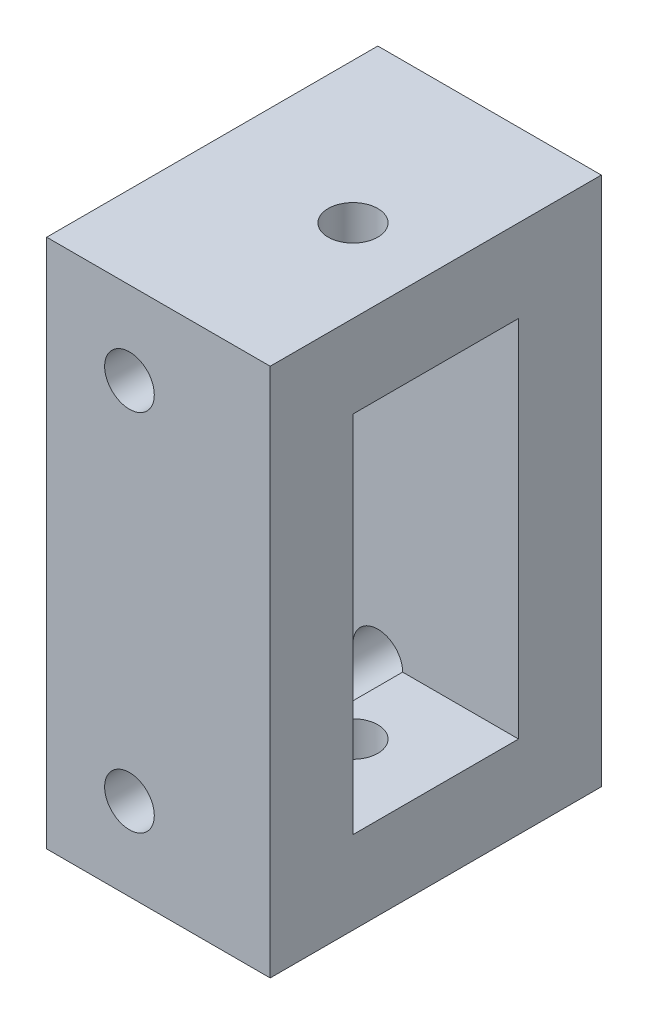
from build123d import *

# Parameters (mm, degrees)
SKETCH1_W           = 13.5
SKETCH1_H           = 20
BOSS_EXTRUDE1_DEPTH = 32
SKETCH2_R           = 1.5
CUT_EXTRUDE1_DEPTH  = 41.078048855
SKETCH3_R           = 1.5
CUT_EXTRUDE2_DEPTH  = 41.078048855
SKETCH4_W           = 10
SKETCH4_H           = 22
CUT_EXTRUDE3_DEPTH  = 41.078048855


with BuildPart() as part:
    # Sketch1 → Boss-Extrude1 (new body)
    with BuildSketch(Plane(origin=(0, 0, 0), x_dir=(1, 0, 0), z_dir=(0, 1, 0))):
        with Locations((6.75, -10)):
            Rectangle(SKETCH1_W, SKETCH1_H)
    extrude(amount=BOSS_EXTRUDE1_DEPTH)

    # Sketch2 → Cut-Extrude1 (cut, through all)
    with BuildSketch(Plane.XY.offset(20)):
        with Locations((5, 27)):
            Circle(SKETCH2_R)
        with Locations((5, 5)):
            Circle(SKETCH2_R)
    extrude(amount=-CUT_EXTRUDE1_DEPTH, mode=Mode.SUBTRACT)

    # Sketch3 → Cut-Extrude2 (cut, through all)
    with BuildSketch(Plane(origin=(0, 32, 0), x_dir=(1, 0, 0), z_dir=(0, 1, 0))):
        with Locations(Location((8.5, -10, 0), (0, 0, 270))):
            Circle(SKETCH3_R)
    extrude(amount=-CUT_EXTRUDE2_DEPTH, mode=Mode.SUBTRACT)

    # Sketch4 → Cut-Extrude3 (cut, through all)
    with BuildSketch(Plane(origin=(13.5, 0, 0), x_dir=(0, 0, -1), z_dir=(1, 0, 0))):
        with Locations((-10, 16)):
            Rectangle(SKETCH4_W, SKETCH4_H)
    extrude(amount=-CUT_EXTRUDE3_DEPTH, mode=Mode.SUBTRACT)


solid = part.part
